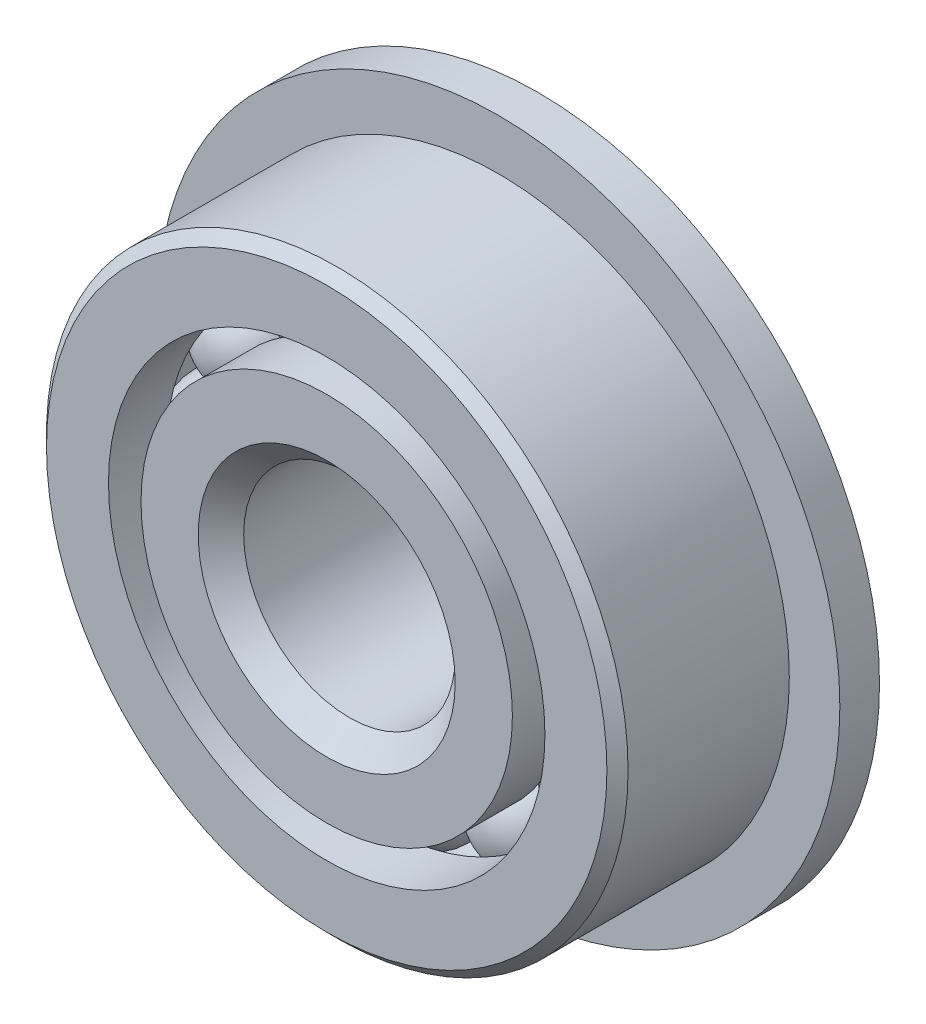
from build123d import *

# Parameters (mm, degrees)
CIRPATTERN1_COUNT = 12
SKETCH5_W         = 1.190625
SKETCH5_H         = 2.765669231


with BuildPart() as part:
    # Sketch1 → Revolve1 (revolve)
    with BuildSketch(Plane(origin=(0, 0, 0), x_dir=(0, 0, -1), z_dir=(1, 0, 0)), mode=Mode.PRIVATE) as revolve1_sk:
        with BuildLine():
            Line((2.8575, 8.73125), (-2.8575, 8.73125))
            Line((-2.8575, 8.73125), (-3.175, 8.41375))
            Line((-3.175, 8.41375), (-3.175, 6.552711538))
            Line((-3.175, 6.552711538), (-1.443600127, 6.552711538))
            ThreePointArc((-1.443600127, 6.552711538), (0, 7.58825), (1.443600127, 6.552711538))
            Line((1.443600127, 6.552711538), (3.175, 6.552711538))
            Line((3.175, 6.552711538), (3.175, 8.41375))
            Line((3.175, 8.41375), (2.8575, 8.73125))
        make_face()
    revolve(revolve1_sk.sketch.rotate(Axis((0, 0, 3.175), (0, 0, -1)), 90), axis=Axis((0, 0, 3.175), (0, 0, -1)))

    # Sketch5 → Revolve5 (revolve)
    with BuildSketch(Plane(origin=(0, 0, 0), x_dir=(0, 0, -1), z_dir=(1, 0, 0)), mode=Mode.PRIVATE) as revolve5_sk:
        with Locations((2.5796875, 8.866065385)):
            Rectangle(SKETCH5_W, SKETCH5_H)
    revolve(revolve5_sk.sketch.rotate(Axis((0, 0, -4.7625), (0, 0, 1)), 270), axis=Axis((0, 0, -4.7625), (0, 0, 1)))


with BuildPart() as body_2:
    # Sketch2 → Revolve2 (revolve)
    with BuildSketch(Plane(origin=(0, 0, 0), x_dir=(0, 0, -1), z_dir=(1, 0, 0)), mode=Mode.PRIVATE) as revolve2_sk:
        with BuildLine():
            Line((-3.175, 5.575788462), (-1.443600127, 5.575788462))
            ThreePointArc((-1.443600127, 5.575788462), (-0.888301924, 4.825906069), (0, 4.54025))
            Line((0, 4.54025), (0, 3.857625))
            Line((0, 3.857625), (-2.315918269, 3.857625))
            Line((-2.315918269, 3.857625), (-3.175, 4.716706731))
            Line((-3.175, 4.716706731), (-3.175, 5.575788462))
        make_face()
    revolve(revolve2_sk.sketch.rotate(Axis((0, 0, 3.175), (0, 0, -1)), 90), axis=Axis((0, 0, 3.175), (0, 0, -1)))

    # Sketch3 → Revolve3 (revolve)
    with BuildSketch(Plane(origin=(0, 0, 0), x_dir=(0, 0, -1), z_dir=(1, 0, 0)), mode=Mode.PRIVATE) as revolve3_sk:
        with BuildLine():
            Line((-3.175, 4.716706731), (-2.315918269, 3.857625))
            Line((-2.315918269, 3.857625), (0, 3.857625))
            Line((0, 3.857625), (0, 4.54025))
            ThreePointArc((0, 4.54025), (0.888301924, 4.825906069), (1.443600127, 5.575788462))
            Line((1.443600127, 5.575788462), (4.7625, 5.575788462))
            Line((4.7625, 5.575788462), (4.7625, 3.4925))
            Line((4.7625, 3.4925), (4.445, 3.175))
            Line((4.445, 3.175), (-2.492375, 3.175))
            Line((-2.492375, 3.175), (-3.175, 3.857625))
            Line((-3.175, 3.857625), (-3.175, 4.716706731))
        make_face()
    revolve(revolve3_sk.sketch.rotate(Axis((0, 0, 3.175), (0, 0, -1)), 90), axis=Axis((0, 0, 3.175), (0, 0, -1)))


with BuildPart() as body_3:
    # Sketch4 → Revolve4 (revolve)
    with BuildSketch(Plane(origin=(0, 0, 0), x_dir=(0, 0, -1), z_dir=(1, 0, 0))):
        with BuildLine():
            Line((-1.524, 6.06425), (1.524, 6.06425))
            ThreePointArc((1.524, 6.06425), (0, 7.58825), (-1.524, 6.06425))
        make_face()
    revolve(axis=Axis((0, 6.06425, 1.524), (0, 0, -1)))


with BuildPart() as cirpattern1_1:
    # CirPattern1: pattern copy
    add(body_3.part.rotate(Axis((0, 0, 0), (0, 0, 1)), 1 * 360 / CIRPATTERN1_COUNT))


with BuildPart() as cirpattern1_2:
    # CirPattern1: pattern copy
    add(body_3.part.rotate(Axis((0, 0, 0), (0, 0, 1)), 2 * 360 / CIRPATTERN1_COUNT))


with BuildPart() as cirpattern1_3:
    # CirPattern1: pattern copy
    add(body_3.part.rotate(Axis((0, 0, 0), (0, 0, 1)), 3 * 360 / CIRPATTERN1_COUNT))


with BuildPart() as cirpattern1_4:
    # CirPattern1: pattern copy
    add(body_3.part.rotate(Axis((0, 0, 0), (0, 0, 1)), 4 * 360 / CIRPATTERN1_COUNT))


with BuildPart() as cirpattern1_5:
    # CirPattern1: pattern copy
    add(body_3.part.rotate(Axis((0, 0, 0), (0, 0, 1)), 5 * 360 / CIRPATTERN1_COUNT))


with BuildPart() as cirpattern1_6:
    # CirPattern1: pattern copy
    add(body_3.part.rotate(Axis((0, 0, 0), (0, 0, 1)), 6 * 360 / CIRPATTERN1_COUNT))


with BuildPart() as cirpattern1_7:
    # CirPattern1: pattern copy
    add(body_3.part.rotate(Axis((0, 0, 0), (0, 0, 1)), 7 * 360 / CIRPATTERN1_COUNT))


with BuildPart() as cirpattern1_8:
    # CirPattern1: pattern copy
    add(body_3.part.rotate(Axis((0, 0, 0), (0, 0, 1)), 8 * 360 / CIRPATTERN1_COUNT))


with BuildPart() as cirpattern1_9:
    # CirPattern1: pattern copy
    add(body_3.part.rotate(Axis((0, 0, 0), (0, 0, 1)), 9 * 360 / CIRPATTERN1_COUNT))


with BuildPart() as cirpattern1_10:
    # CirPattern1: pattern copy
    add(body_3.part.rotate(Axis((0, 0, 0), (0, 0, 1)), 10 * 360 / CIRPATTERN1_COUNT))


with BuildPart() as cirpattern1_11:
    # CirPattern1: pattern copy
    add(body_3.part.rotate(Axis((0, 0, 0), (0, 0, 1)), 11 * 360 / CIRPATTERN1_COUNT))


solid = Compound([part.part, body_2.part, body_3.part, cirpattern1_1.part, cirpattern1_2.part, cirpattern1_3.part, cirpattern1_4.part, cirpattern1_5.part, cirpattern1_6.part, cirpattern1_7.part, cirpattern1_8.part, cirpattern1_9.part, cirpattern1_10.part, cirpattern1_11.part])
